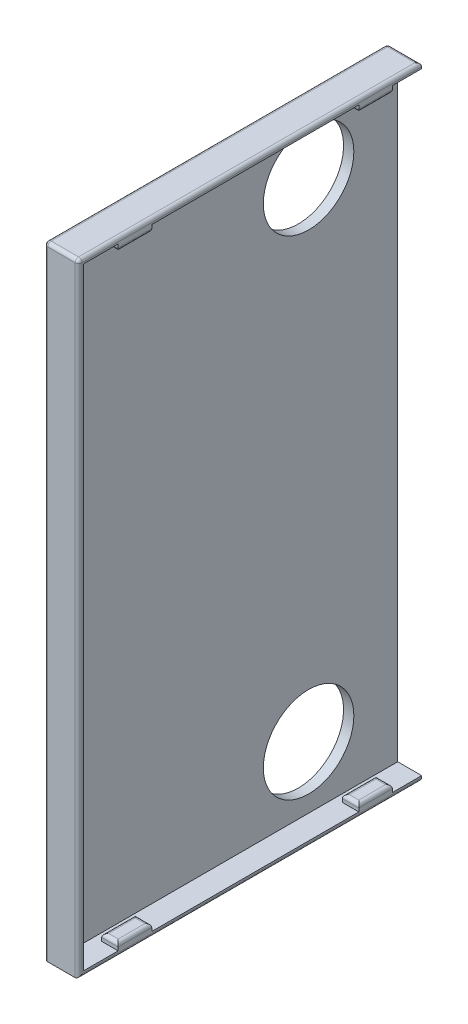
from build123d import *

# Parameters (mm, degrees)
ESBO_O1_W                 = 181.6
ESBO_O1_H                 = 103.1
RESSALTO_EXTRUS_O1_DEPTH  = 10
ESBO_O2_W                 = 178.6
ESBO_O2_H                 = 100.1
CORTE_EXTRUS_O1_DEPTH     = 7
ESBO_O4_W                 = 4.8
ESBO_O4_H                 = 9.8
RESSALTO_EXTRUS_O2_DEPTH  = 2
ESPELHAR2_COPY_1_SKETCH_W = 4.8
ESPELHAR2_COPY_1_SKETCH_H = 9.8
ESPELHAR2_COPY_1_DEPTH    = 2
ESBO_O5_W                 = 10
ESBO_O5_H                 = 181.6
CORTE_EXTRUS_O2_DEPTH     = 3
FILETE3_R                 = 1
FILETE6_R                 = 1
FILETE7_R                 = 1
FILETE8_R                 = 1
ESBO_O6_R                 = 13.2
CORTE_EXTRUS_O3_DEPTH     = 10


with BuildPart() as part:
    # Esboço1 → Ressalto-extrusão1 (new body)
    with BuildSketch(Plane.YZ):
        Rectangle(ESBO_O1_W, ESBO_O1_H)
    extrude(amount=RESSALTO_EXTRUS_O1_DEPTH)

    # Esboço2 → Corte-extrusão1 (cut)
    with BuildSketch(Plane.YZ.offset(10)):
        Rectangle(ESBO_O2_W, ESBO_O2_H)
    extrude(amount=-CORTE_EXTRUS_O1_DEPTH, mode=Mode.SUBTRACT)

    # Esboço4 → Ressalto-extrusão2 (add)
    with BuildSketch(Plane(origin=(0, -89.3, 0), x_dir=(-1, 0, 0), z_dir=(0, 1, 0))):
        with Locations((-7.6, 35.1)):
            Rectangle(ESBO_O4_W, ESBO_O4_H)
    ressalto_extrus_o2 = extrude(amount=RESSALTO_EXTRUS_O2_DEPTH)

    # Espelhar1: Ressalto-extrusão2 across plane
    add(ressalto_extrus_o2.mirror(Plane.XY))

    # Espelhar2: Ressalto-extrusão2 across plane
    add(ressalto_extrus_o2.mirror(Plane.ZX))

    # Espelhar2 copy 1 sketch → Espelhar2 copy 1 (add)
    with BuildSketch(Plane(origin=(0, 89.3, 0), x_dir=(-1, 0, 0), z_dir=(0, -1, 0))):
        with Locations((-7.6, 35.1)):
            Rectangle(ESPELHAR2_COPY_1_SKETCH_W, ESPELHAR2_COPY_1_SKETCH_H)
    extrude(amount=ESPELHAR2_COPY_1_DEPTH)

    # Esboço5 → Corte-extrusão2 (cut)
    with BuildSketch(Plane(origin=(0, 0, -51.55), x_dir=(1, 0, 0), z_dir=(0, 0, -1))):
        with Locations((5, 0)):
            Rectangle(ESBO_O5_W, ESBO_O5_H)
    extrude(amount=-CORTE_EXTRUS_O2_DEPTH, mode=Mode.SUBTRACT)

    # Filete3
    filete3_edges = [part.edges().sort_by_distance(p)[0] for p in [
        (10, 0, 51.55),
        (10, -90.8, 1.5),
        (0, 0, 51.55),
        (0, -90.8, 1.5),
        (5, 90.8, 51.55),
        (0, 90.8, 1.5),
        (10, 90.8, 1.5),
        (0, 0, -48.55),
        (5, -90.8, -48.55),
        (5, 90.8, -48.55),
    ]]
    fillet(filete3_edges, radius=FILETE3_R)

    # Filete6
    filete6_edges = [part.edges().sort_by_distance(p)[0] for p in [
        (5.2, -87.3, 35.1),
        (7.6, -87.3, 40),
        (10, -87.3, 35.1),
        (7.6, -87.3, 30.2),
    ]]
    fillet(filete6_edges, radius=FILETE6_R)

    # Filete7
    filete7_edges = [part.edges().sort_by_distance(p)[0] for p in [
        (10, -87.3, -35.1),
        (7.6, -87.3, -30.2),
        (7.6, -87.3, -40),
        (5.2, -87.3, -35.1),
    ]]
    fillet(filete7_edges, radius=FILETE7_R)

    # Filete8
    filete8_edges = [part.edges().sort_by_distance(p)[0] for p in [
        (5.2, 87.3, -35.1),
        (7.6, 87.3, -40),
        (10, 87.3, -35.1),
        (7.6, 87.3, -30.2),
        (10, 87.3, 35.1),
        (7.6, 87.3, 30.2),
        (7.6, 87.3, 40),
        (5.2, 87.3, 35.1),
    ]]
    fillet(filete8_edges, radius=FILETE8_R)

    # Esboço6 → Corte-extrusão3 (cut)
    with BuildSketch(Plane(origin=(0, 0, 0), x_dir=(0, -1, 0), z_dir=(-1, 0, 0))):
        with Locations(Location((-71.25, -22.55, 0), (0, 0, 90))):
            Circle(ESBO_O6_R)
    corte_extrus_o3 = extrude(amount=-CORTE_EXTRUS_O3_DEPTH, mode=Mode.SUBTRACT)

    # Espelhar3: Corte-extrusão3 across plane
    add(corte_extrus_o3.mirror(Plane.ZX), mode=Mode.SUBTRACT)


solid = part.part
